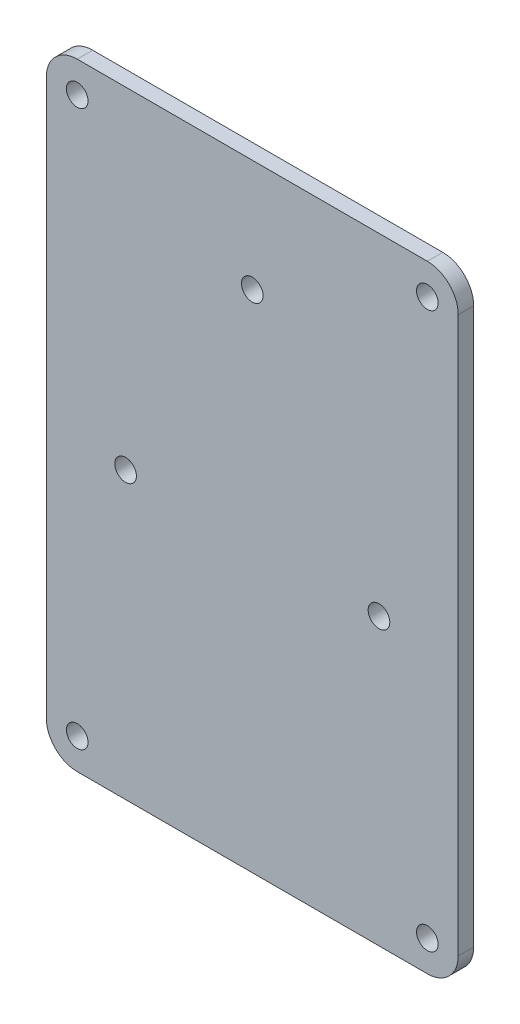
from build123d import *

# Parameters (mm, degrees)
IZIM1_R                     = 2.1
Y_KSEKLIK_EKSTR_ZYON1_DEPTH = 3
IZIM2_R                     = 2.1
KES_EKSTR_ZYON1_DEPTH       = 10


with BuildPart() as part:
    # Çizim1 → Yükseklik-Ekstrüzyon1 (new body)
    with BuildSketch(Plane.XY):
        with BuildLine():
            Line((22.039642989, -38.504590939), (22.039642989, 69.347448082))
            ThreePointArc((22.039642989, 69.347448082), (20.282283676, 73.590088769), (16.039642989, 75.347448082))
            Line((16.039642989, 75.347448082), (-51.960357011, 75.347448082))
            ThreePointArc((-51.960357011, 75.347448082), (-56.202997698, 73.590088769), (-57.960357011, 69.347448082))
            Line((-57.960357011, 69.347448082), (-57.960357011, -38.504590939))
            ThreePointArc((-57.960357011, -38.504590939), (-56.202997698, -42.747231626), (-51.960357011, -44.504590939))
            Line((-51.960357011, -44.504590939), (16.039642989, -44.504590939))
            ThreePointArc((16.039642989, -44.504590939), (20.282283676, -42.747231626), (22.039642989, -38.504590939))
        make_face()
        with Locations((-51.960357011, -38.504590939)):
            Circle(IZIM1_R, mode=Mode.SUBTRACT)
        with Locations((16.039642989, -38.504590939)):
            Circle(IZIM1_R, mode=Mode.SUBTRACT)
        with Locations((16.039642989, 69.347448082)):
            Circle(IZIM1_R, mode=Mode.SUBTRACT)
        with Locations((-51.960357011, 69.347448082)):
            Circle(IZIM1_R, mode=Mode.SUBTRACT)
    extrude(amount=Y_KSEKLIK_EKSTR_ZYON1_DEPTH)

    # Çizim2 → Kes-Ekstrüzyon1 (cut)
    with BuildSketch(Plane(origin=(0, 0, 0), x_dir=(-1, 0, 0), z_dir=(0, 0, -1))):
        with Locations((17.960357011, 53.578572425)):
            Circle(IZIM2_R)
        with Locations((42.568052166, 10.95679416)):
            Circle(IZIM2_R)
        with Locations((-6.647338144, 10.95679416)):
            Circle(IZIM2_R)
    extrude(amount=-KES_EKSTR_ZYON1_DEPTH, mode=Mode.SUBTRACT)


solid = part.part
